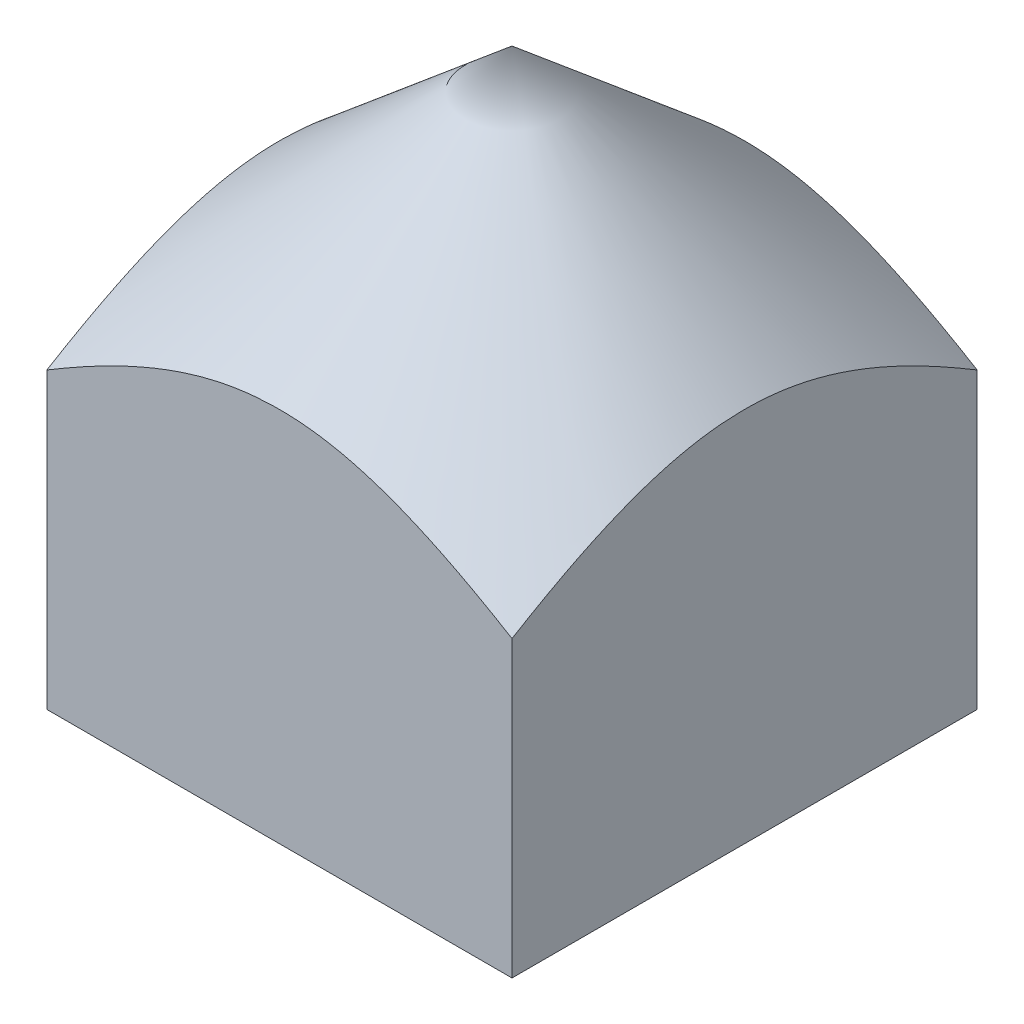
from build123d import *

# Parameters (mm, degrees)
ESBO_O1_W                = 60
ESBO_O1_H                = 60
RESSALTO_EXTRUS_O1_DEPTH = 80


with BuildPart() as part:
    # Esboço1 → Ressalto-extrusão1 (new body)
    with BuildSketch(Plane(origin=(0, 0, 0), x_dir=(1, 0, 0), z_dir=(0, 1, 0))):
        Rectangle(ESBO_O1_W, ESBO_O1_H)
    extrude(amount=RESSALTO_EXTRUS_O1_DEPTH)

    # Esboço2 → Corte-Revolução7 (revolve, cut)
    with BuildSketch(Plane.XY, mode=Mode.PRIVATE) as corte_revolu_o7_sk:
        Polygon((0, 88.590555417), (0, 74.111566705), (56.998118831, 25.487386579), (56.998118831, 88.590555417), align=None)
    revolve(corte_revolu_o7_sk.sketch.rotate(Axis((0, 88.590555417, 0), (0, -1, 0)), 270), axis=Axis((0, 88.590555417, 0), (0, -1, 0)), mode=Mode.SUBTRACT)


solid = part.part
